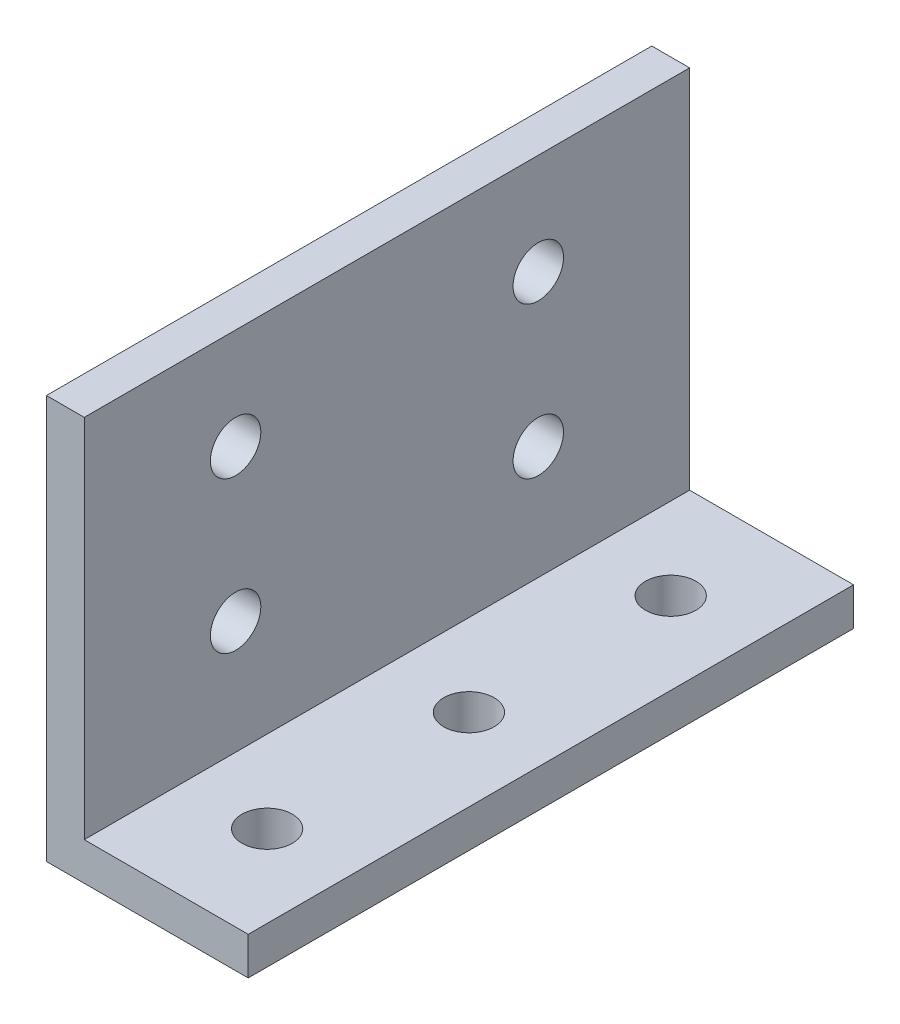
from build123d import *

# Parameters (mm, degrees)
BOSS_EXTRUDE1_DEPTH = 76.2
CUT_EXTRUDE1_REACH  = 93.388
SKETCH2_R           = 3.175
CUT_EXTRUDE2_REACH  = 93.388
SKETCH3_R           = 3.175


with BuildPart() as part:
    # Sketch1 → Boss-Extrude1 (new body)
    with BuildSketch(Plane.XY):
        Polygon((0, 0), (0, 46.0375), (-4.7625, 46.0375), (-4.7625, -4.7625), (20.6375, -4.7625), (20.6375, 0), align=None)
    extrude(amount=BOSS_EXTRUDE1_DEPTH)

    # Sketch2 → Cut-Extrude1 (cut, up to next)
    with BuildSketch(Plane(origin=(0, 0, 0), x_dir=(0, 0, -1), z_dir=(1, 0, 0)), mode=Mode.PRIVATE) as cut_extrude1_sk1:
        with Locations((-57.15, 33.3375)):
            Circle(SKETCH2_R)
    cut_extrude1_tool1 = extrude(cut_extrude1_sk1.sketch, amount=-CUT_EXTRUDE1_REACH, mode=Mode.PRIVATE) & part.part
    # Sketch2 → Cut-Extrude1 (cut, up to next)
    with BuildSketch(Plane(origin=(0, 0, 0), x_dir=(0, 0, -1), z_dir=(1, 0, 0)), mode=Mode.PRIVATE) as cut_extrude1_sk2:
        with Locations((-19.05, 33.3375)):
            Circle(SKETCH2_R)
    cut_extrude1_tool2 = extrude(cut_extrude1_sk2.sketch, amount=-CUT_EXTRUDE1_REACH, mode=Mode.PRIVATE) & part.part
    # Sketch2 → Cut-Extrude1 (cut, up to next)
    with BuildSketch(Plane(origin=(0, 0, 0), x_dir=(0, 0, -1), z_dir=(1, 0, 0)), mode=Mode.PRIVATE) as cut_extrude1_sk3:
        with Locations((-19.05, 14.2875)):
            Circle(SKETCH2_R)
    cut_extrude1_tool3 = extrude(cut_extrude1_sk3.sketch, amount=-CUT_EXTRUDE1_REACH, mode=Mode.PRIVATE) & part.part
    # Sketch2 → Cut-Extrude1 (cut, up to next)
    with BuildSketch(Plane(origin=(0, 0, 0), x_dir=(0, 0, -1), z_dir=(1, 0, 0)), mode=Mode.PRIVATE) as cut_extrude1_sk4:
        with Locations((-57.15, 14.2875)):
            Circle(SKETCH2_R)
    cut_extrude1_tool4 = extrude(cut_extrude1_sk4.sketch, amount=-CUT_EXTRUDE1_REACH, mode=Mode.PRIVATE) & part.part
    add(cut_extrude1_tool1.solids().sort_by_distance((0, 33.3375, 57.15))[0], mode=Mode.SUBTRACT)
    add(cut_extrude1_tool2.solids().sort_by_distance((0, 33.3375, 19.05))[0], mode=Mode.SUBTRACT)
    add(cut_extrude1_tool3.solids().sort_by_distance((0, 14.2875, 19.05))[0], mode=Mode.SUBTRACT)
    add(cut_extrude1_tool4.solids().sort_by_distance((0, 14.2875, 57.15))[0], mode=Mode.SUBTRACT)

    # Sketch3 → Cut-Extrude2 (cut, up to next)
    with BuildSketch(Plane(origin=(0, 0, 0), x_dir=(1, 0, 0), z_dir=(0, 1, 0)), mode=Mode.PRIVATE) as cut_extrude2_sk1:
        with Locations(Location((10.31875, -12.7, 0), (0, 0, 270))):
            Circle(SKETCH3_R)
    cut_extrude2_tool1 = extrude(cut_extrude2_sk1.sketch, amount=-CUT_EXTRUDE2_REACH, mode=Mode.PRIVATE) & part.part
    # Sketch3 → Cut-Extrude2 (cut, up to next)
    with BuildSketch(Plane(origin=(0, 0, 0), x_dir=(1, 0, 0), z_dir=(0, 1, 0)), mode=Mode.PRIVATE) as cut_extrude2_sk2:
        with Locations(Location((10.31875, -63.5, 0), (0, 0, 270))):
            Circle(SKETCH3_R)
    cut_extrude2_tool2 = extrude(cut_extrude2_sk2.sketch, amount=-CUT_EXTRUDE2_REACH, mode=Mode.PRIVATE) & part.part
    # Sketch3 → Cut-Extrude2 (cut, up to next)
    with BuildSketch(Plane(origin=(0, 0, 0), x_dir=(1, 0, 0), z_dir=(0, 1, 0)), mode=Mode.PRIVATE) as cut_extrude2_sk3:
        with Locations(Location((10.31875, -38.1, 0), (0, 0, 270))):
            Circle(SKETCH3_R)
    cut_extrude2_tool3 = extrude(cut_extrude2_sk3.sketch, amount=-CUT_EXTRUDE2_REACH, mode=Mode.PRIVATE) & part.part
    add(cut_extrude2_tool1.solids().sort_by_distance((10.31875, 0, 12.7))[0], mode=Mode.SUBTRACT)
    add(cut_extrude2_tool2.solids().sort_by_distance((10.31875, 0, 63.5))[0], mode=Mode.SUBTRACT)
    add(cut_extrude2_tool3.solids().sort_by_distance((10.31875, 0, 38.1))[0], mode=Mode.SUBTRACT)


solid = part.part
